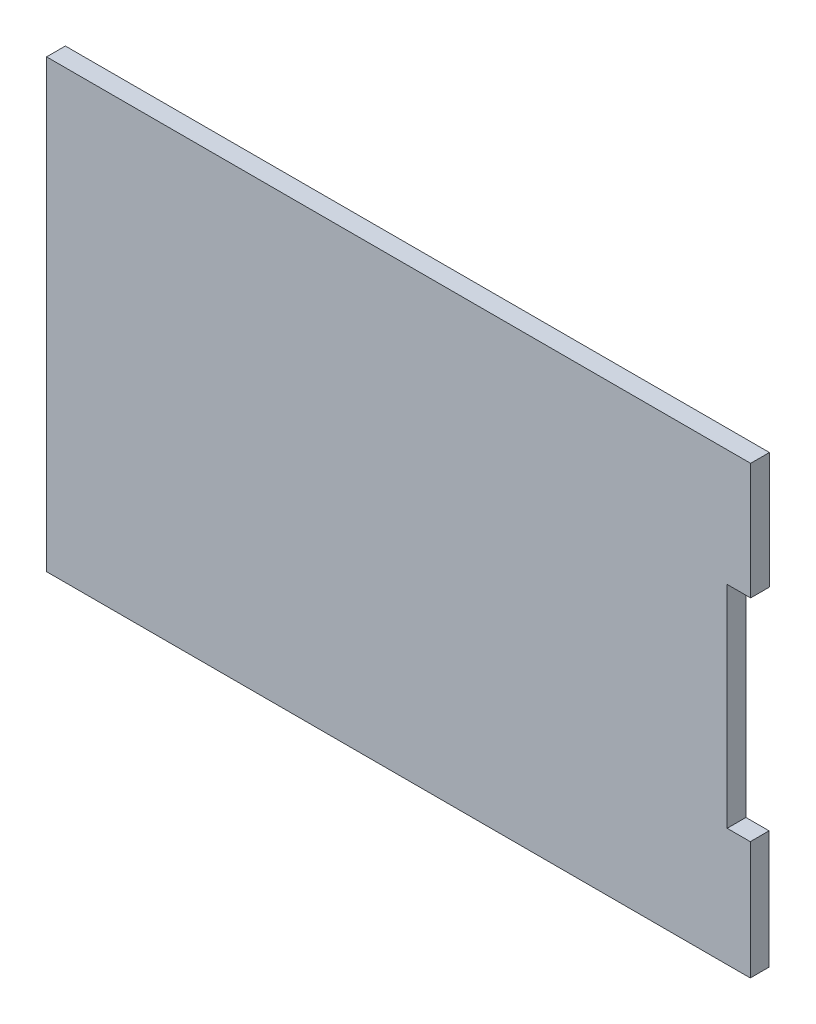
from build123d import *

# Parameters (mm, degrees)
SKETCH_1_W      = 39.1
SKETCH_1_H      = 25.4
EXTRUDE_1_DEPTH = 0.3
EXTRUDE_2_DEPTH = 1.6
SKETCH_3_W      = 6
SKETCH_3_H      = 6
EXTRUDE_3_DEPTH = 5


with BuildPart() as part:
    # 草图1 → 凸台-拉伸1 (new body)
    with BuildSketch(Plane.XY):
        Rectangle(SKETCH_1_W, SKETCH_1_H)
    extrude(amount=EXTRUDE_1_DEPTH)


with BuildPart() as body_2:
    # 草图2 → 凸台-拉伸2 (new body)
    with BuildSketch(Plane.XY.offset(0.3)):
        Polygon((23.55, 9.068338111), (23.55, 19.004767958), (-36.45, 19.004767958), (-36.45, -18.995220086), (23.51985639, -18.995220086), (23.51985639, -8.931661889), (21.55, -8.931661889), (21.55, 9.068338111), align=None)
    extrude(amount=EXTRUDE_2_DEPTH)

    # 草图3 → 凸台-拉伸3 (add)
    with BuildSketch(Plane(origin=(0, 0, 0.3), x_dir=(-1, 0, 0), z_dir=(0, 0, -1))):
        with Locations((25.45, 10.504767958)):
            Rectangle(SKETCH_3_W, SKETCH_3_H)
        with Locations((25.45, 0.004779914)):
            Rectangle(SKETCH_3_W, SKETCH_3_H)
        with Locations((25.45, -10.495220086)):
            Rectangle(SKETCH_3_W, SKETCH_3_H)
    extrude(amount=EXTRUDE_3_DEPTH)


solid = Compound([part.part, body_2.part])
